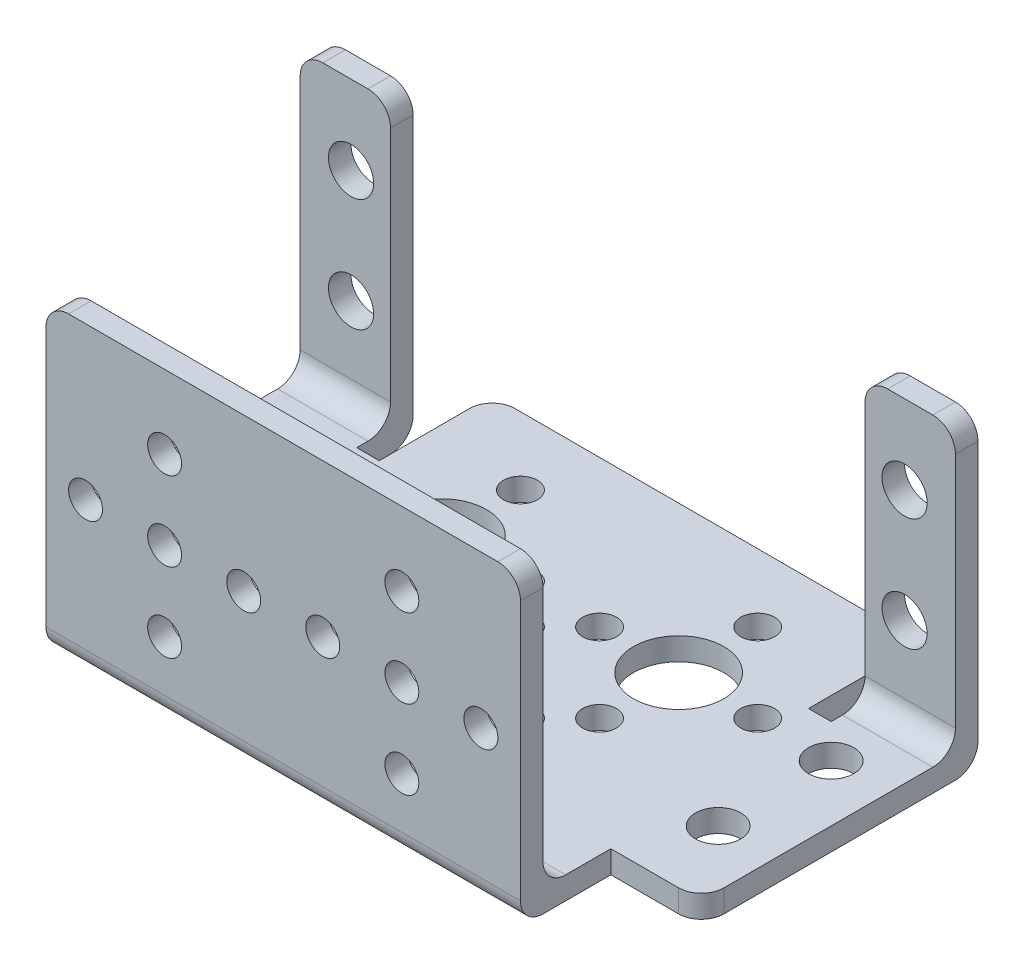
from build123d import *

# Parameters (mm, degrees)
SKETCH_1_R          = 1.5
SKETCH_1_R_2        = 2
SKETCH_1_R_3        = 4
EXTRUDE_1_DEPTH     = 2
SKETCH_2_W          = 8
SKETCH_2_H          = 2
EXTRUDE_2_DEPTH     = 25
SKETCH_3_R          = 2
CUT_EXTRUDE_1_DEPTH = 51.002499938
SKETCH_4_W          = 42
SKETCH_4_H          = 2
EXTRUDE_3_DEPTH     = 25
SKETCH_5_R          = 1.5
CUT_EXTRUDE_2_DEPTH = 25
FILLET_1_R          = 2
FILLET_2_R          = 2


with BuildPart() as part:
    # 草图1 → 凸台-拉伸1 (new body)
    with BuildSketch(Plane(origin=(0, 0, 0), x_dir=(1, 0, 0), z_dir=(0, 1, 0))):
        with BuildLine():
            Line((0, -19), (0, -24.5))
            Line((0, -24.5), (21, -24.5))
            Line((21, -24.5), (21, -16.5))
            Line((21, -16.5), (27, -16.5))
            ThreePointArc((27, -16.5), (28.414213562, -15.914213562), (29, -14.5))
            Line((29, -14.5), (29, 8))
            Line((29, 8), (21, 8))
            Line((21, 8), (21, 3))
            Line((21, 3), (19, 3))
            Line((19, 3), (19, 11))
            ThreePointArc((19, 11), (18.414213562, 12.414213562), (17, 13))
            Line((17, 13), (0, 13))
            Line((0, 13), (0, -2))
            ThreePointArc((0, -2), (1.060660172, -2.439339828), (1.5, -3.5))
            ThreePointArc((1.5, -3.5), (1.060660172, -4.560660172), (0, -5))
            Line((0, -5), (0, -6.5))
            ThreePointArc((0, -6.5), (2.828427125, -7.671572875), (4, -10.5))
            ThreePointArc((4, -10.5), (2.828427125, -13.328427125), (0, -14.5))
            Line((0, -14.5), (0, -16))
            ThreePointArc((0, -16), (1.060660172, -16.439339828), (1.5, -17.5))
            ThreePointArc((1.5, -17.5), (1.060660172, -18.560660172), (0, -19))
        make_face()
        with Locations(Location((7, -10.5, 0), (0, 0, 270))):
            Circle(SKETCH_1_R, mode=Mode.SUBTRACT)
        with Locations(Location((10.5, -7, 0), (0, 0, 270))):
            Circle(SKETCH_1_R, mode=Mode.SUBTRACT)
        with Locations(Location((24, -10, 0), (0, 0, 270))):
            Circle(SKETCH_1_R_2, mode=Mode.SUBTRACT)
        with Locations(Location((3.5, 0, 0), (0, 0, 270))):
            Circle(SKETCH_1_R, mode=Mode.SUBTRACT)
        with Locations(Location((10.5, 0, 0), (0, 0, 270))):
            Circle(SKETCH_1_R_3, mode=Mode.SUBTRACT)
        with Locations(Location((10.5, 7, 0), (0, 0, 270))):
            Circle(SKETCH_1_R, mode=Mode.SUBTRACT)
        with Locations(Location((17.5, 0, 0), (0, 0, 270))):
            Circle(SKETCH_1_R, mode=Mode.SUBTRACT)
        with Locations(Location((24, 0, 0), (0, 0, 270))):
            Circle(SKETCH_1_R_2, mode=Mode.SUBTRACT)
    extrude_1 = extrude(amount=EXTRUDE_1_DEPTH)

    # 草图2 → 凸台-拉伸2 (add)
    with BuildSketch(Plane(origin=(0, 2, 0), x_dir=(1, 0, 0), z_dir=(0, 1, 0))):
        with Locations((25, 7)):
            Rectangle(SKETCH_2_W, SKETCH_2_H)
    extrude_2 = extrude(amount=EXTRUDE_2_DEPTH)

    # 草图3 → 切除-拉伸1 (cut, through all)
    with BuildSketch(Plane.XY.offset(-6)):
        with Locations((24.5, 10)):
            Circle(SKETCH_3_R)
        with Locations((24.5, 20)):
            Circle(SKETCH_3_R)
        with BuildLine():
            ThreePointArc((21, 25), (21.585786438, 26.414213562), (23, 27))
            Line((23, 27), (21, 27))
            Line((21, 27), (21, 25))
        make_face()
        with BuildLine():
            Line((29, 27), (27, 27))
            ThreePointArc((27, 27), (28.414213562, 26.414213562), (29, 25))
            Line((29, 25), (29, 27))
        make_face()
    cut_extrude_1 = extrude(amount=-CUT_EXTRUDE_1_DEPTH, mode=Mode.SUBTRACT)

    # 镜向1: 凸台-拉伸1, 凸台-拉伸2, 切除-拉伸1 across plane
    add(extrude_1.mirror(Plane(origin=(0, 2, 0), x_dir=(0, 0, 1), z_dir=(1, 0, 0))))
    add(extrude_2.mirror(Plane(origin=(0, 2, 0), x_dir=(0, 0, 1), z_dir=(1, 0, 0))))
    add(cut_extrude_1.mirror(Plane(origin=(0, 2, 0), x_dir=(0, 0, 1), z_dir=(1, 0, 0))), mode=Mode.SUBTRACT)

    # 草图4 → 凸台-拉伸3 (add)
    with BuildSketch(Plane(origin=(0, 2, 0), x_dir=(1, 0, 0), z_dir=(0, 1, 0))):
        with Locations((0, -23.5)):
            Rectangle(SKETCH_4_W, SKETCH_4_H)
    extrude(amount=EXTRUDE_3_DEPTH)

    # 草图5 → 切除-拉伸2 (cut)
    with BuildSketch(Plane.XY.offset(24.5)):
        with Locations((-10.5, 13.5)):
            Circle(SKETCH_5_R)
        with Locations((10.5, 13.5)):
            Circle(SKETCH_5_R)
        with Locations((-10.5, 20.5)):
            Circle(SKETCH_5_R)
        with Locations((-3.5, 13.5)):
            Circle(SKETCH_5_R)
        with Locations((-10.5, 6.5)):
            Circle(SKETCH_5_R)
        with Locations((-17.5, 13.5)):
            Circle(SKETCH_5_R)
        with Locations((10.5, 20.5)):
            Circle(SKETCH_5_R)
        with Locations((17.5, 13.5)):
            Circle(SKETCH_5_R)
        with Locations((10.5, 6.5)):
            Circle(SKETCH_5_R)
        with Locations((3.5, 13.5)):
            Circle(SKETCH_5_R)
    extrude(amount=-CUT_EXTRUDE_2_DEPTH, mode=Mode.SUBTRACT)

    # 圆角1
    fillet_1_edges = [part.edges().sort_by_distance(p)[0] for p in [
        (-21, 27, 23.5),
        (21, 27, 23.5),
    ]]
    fillet(fillet_1_edges, radius=FILLET_1_R)

    # 圆角2
    fillet_2_edges = [part.edges().sort_by_distance(p)[0] for p in [
        (-25, 0, -8),
        (-25, 2, -6),
        (0, 2, 22.5),
        (25, 0, -8),
        (0, 0, 24.5),
        (25, 2, -6),
    ]]
    fillet(fillet_2_edges, radius=FILLET_2_R)


solid = part.part
